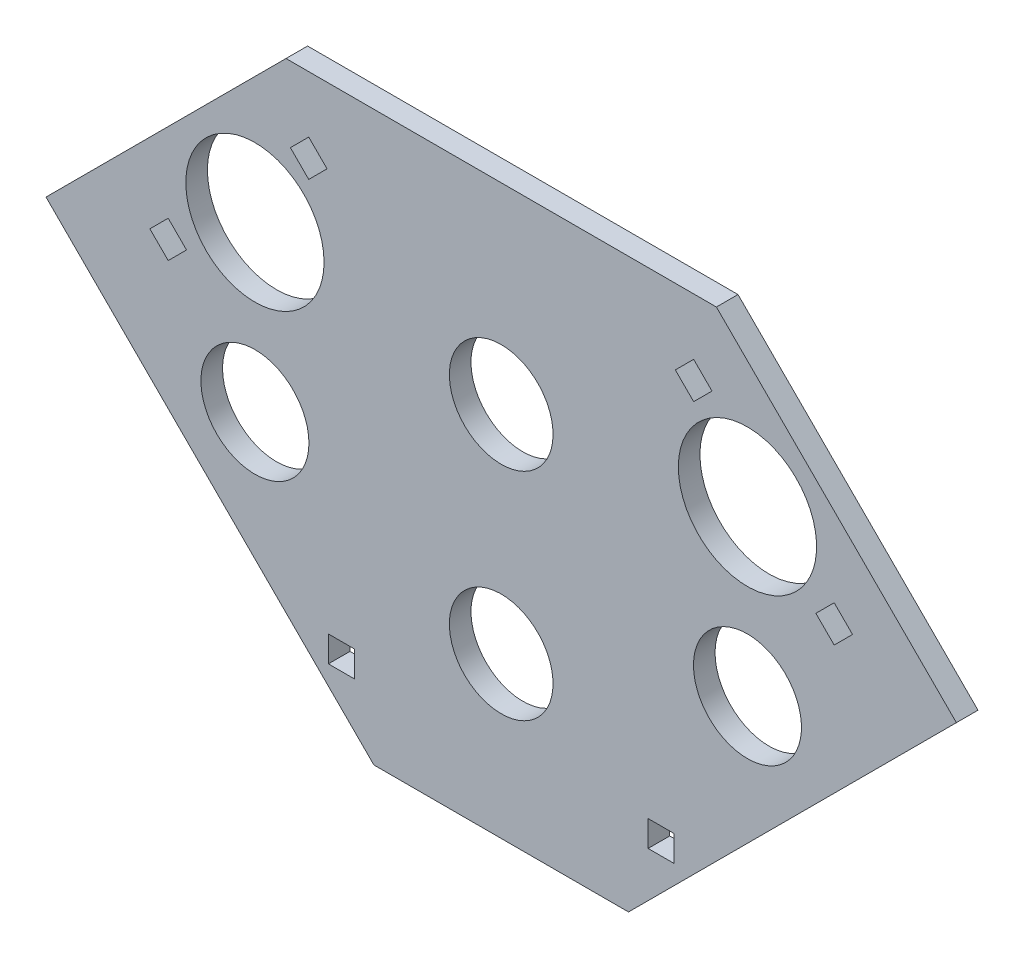
from build123d import *

# Parameters (mm, degrees)
SKETCH3_R           = 12
BOSS_EXTRUDE1_DEPTH = 5
BOSS_EXTRUDE2_DEPTH = 5
SKETCH6_R           = 16
SKETCH6_R_2         = 12.5
SKETCH6_W           = 6
SKETCH6_H           = 6
CUT_EXTRUDE1_DEPTH  = 5


with BuildPart() as part:
    # Sketch3 → Boss-Extrude1 (new body)
    with BuildSketch(Plane.XY):
        Polygon((-77.781745931, 49.497474683), (-49.497474683, 77.781745931), (-43.840620434, 83.43860018), (43.840620434, 83.43860018), (49.497474683, 77.781745931), (77.781745931, 49.497474683), (88.388347648, 38.890872965), (27.497474683, -22), (-27.497474683, -22), (-88.388347648, 38.890872965), align=None)
        Circle(SKETCH3_R, mode=Mode.SUBTRACT)
        with Locations((0, 50)):
            Circle(SKETCH3_R, mode=Mode.SUBTRACT)
        Polygon((-81.317279836, 44.547727215), (-77.074639149, 48.790367902), (-72.831998462, 44.547727215), (-77.074639149, 40.305086528), align=None, mode=Mode.SUBTRACT)
        Polygon((-48.790367902, 77.074639149), (-44.547727215, 81.317279836), (-40.305086528, 77.074639149), (-44.547727215, 72.831998462), align=None, mode=Mode.SUBTRACT)
        Polygon((40.305086528, 77.074639149), (44.547727215, 72.831998462), (48.790367902, 77.074639149), (44.547727215, 81.317279836), align=None, mode=Mode.SUBTRACT)
        Polygon((72.831998462, 44.547727215), (77.074639149, 40.305086528), (81.317279836, 44.547727215), (77.074639149, 48.790367902), align=None, mode=Mode.SUBTRACT)
    extrude(amount=BOSS_EXTRUDE1_DEPTH)

    # Sketch5 → Boss-Extrude2 (add)
    with BuildSketch(Plane.XY.offset(5)):
        Polygon((-105.358910397, 38.890872965), (-49.811183182, 94.43860018), (49.811183182, 94.43860018), (105.358910397, 38.890872965), (29.468037432, -37), (-29.468037432, -37), align=None)
        Polygon((-43.840620434, 83.43860018), (-88.388347648, 38.890872965), (-27.497474683, -22), (27.497474683, -22), (88.388347648, 38.890872965), (43.840620434, 83.43860018), align=None, mode=Mode.SUBTRACT)
    extrude(amount=-BOSS_EXTRUDE2_DEPTH)

    # Sketch6 → Cut-Extrude1 (cut)
    with BuildSketch(Plane.XY.offset(5)):
        with Locations((-57, 58)):
            Circle(SKETCH6_R)
        with Locations((-57, 20)):
            Circle(SKETCH6_R_2)
        with Locations(Location((57, 20, 0), (0, 0, 180))):
            Circle(SKETCH6_R_2)
        with Locations(Location((57, 58, 0), (0, 0, 180))):
            Circle(SKETCH6_R)
        with Locations((-37, -19)):
            Rectangle(SKETCH6_W, SKETCH6_H)
        with Locations((37, -19)):
            Rectangle(SKETCH6_W, SKETCH6_H)
    extrude(amount=-CUT_EXTRUDE1_DEPTH, mode=Mode.SUBTRACT)


solid = part.part
